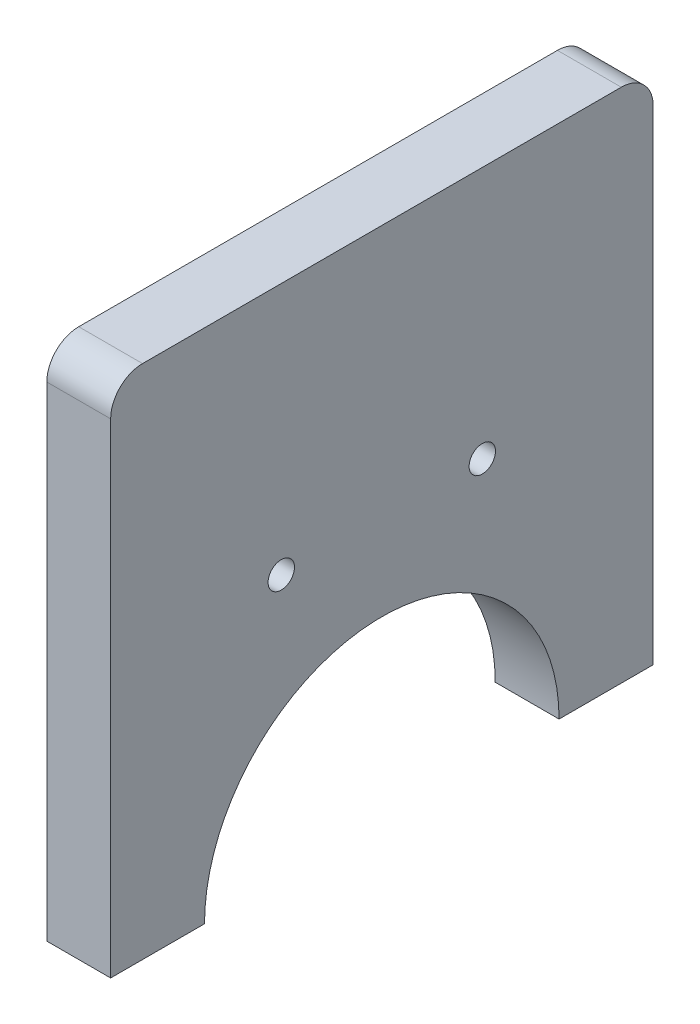
from build123d import *

# Parameters (mm, degrees)
BOSS_EXTRUDE1_START     = 5.08
BOSS_EXTRUDE1_DEPTH     = 43.18
SKETCH2_W               = 51
SKETCH2_H               = 8.231998532
BOSS_EXTRUDE2_DEPTH     = 5.08
CUT_EXTRUDE1_DEPTH      = 100.957396182
CUT_EXTRUDE1_DEPTH_BACK = 5.08
SKETCH3_R               = 1.05
SKETCH4_R               = 1.25
CUT_EXTRUDE2_DEPTH      = 5.08
SKETCH5_W               = 51
SKETCH5_H               = 8.231998532
BOSS_EXTRUDE3_DEPTH     = 5.08
BOSS_EXTRUDE4_DEPTH     = 5.08
FILLET1_R               = 2.54
SKETCH7_W               = 75.202673557
SKETCH7_H               = 41.660019182
CUT_EXTRUDE3_DEPTH      = 80.950255842


with BuildPart() as part:
    # Sketch1 → Boss-Extrude1 (new body)
    with BuildSketch(Plane.XY.offset(58.730428606).offset(BOSS_EXTRUDE1_START)):
        Polygon((-14.213699035, 28.595837466), (-14.213699035, 47.595837466), (36.786300965, 47.595837466), (36.786300965, 28.595837466), (41.866300965, 28.595837466), (41.866300965, 52.675837466), (-19.293699035, 52.675837466), (-19.293699035, 28.595837466), align=None)
    extrude(amount=-BOSS_EXTRUDE1_DEPTH)

    # Sketch2 → Boss-Extrude2 (add)
    with BuildSketch(Plane(origin=(0, 0, 20.630428606), x_dir=(-1, 0, 0), z_dir=(0, 0, -1))):
        with Locations((-11.286300965, 43.4798382)):
            Rectangle(SKETCH2_W, SKETCH2_H)
    extrude(amount=-BOSS_EXTRUDE2_DEPTH)

    # Sketch3 → Cut-Extrude1 (cut, two sides: drawn at the far end of the back side and taken through both)
    with BuildSketch(Plane.ZY.offset(-36.786300965).offset(-CUT_EXTRUDE1_DEPTH_BACK)):
        with Locations(Location((50.230428606, 32.595837466, 0), (0, 0, 180))):
            Circle(SKETCH3_R)
        with Locations(Location((34.230428606, 32.595837466, 0), (0, 0, 180))):
            Circle(SKETCH3_R)
    extrude(amount=CUT_EXTRUDE1_DEPTH + CUT_EXTRUDE1_DEPTH_BACK, mode=Mode.SUBTRACT)

    # Sketch4 → Cut-Extrude2 (cut)
    with BuildSketch(Plane(origin=(0, 47.595837466, 0), x_dir=(-1, 0, 0), z_dir=(0, -1, 0))):
        with Locations(Location((-22.286300965, -42.230428606, 0), (0, 0, 90))):
            Circle(SKETCH4_R)
        with Locations(Location((-11.286300965, -53.230428606, 0), (0, 0, 90))):
            Circle(SKETCH4_R)
        with Locations(Location((-11.286300965, -31.230428606, 0), (0, 0, 90))):
            Circle(SKETCH4_R)
        with Locations(Location((-0.286300965, -42.230428606, 0), (0, 0, 90))):
            Circle(SKETCH4_R)
    extrude(amount=-CUT_EXTRUDE2_DEPTH, mode=Mode.SUBTRACT)

    # Sketch5 → Boss-Extrude3 (add)
    with BuildSketch(Plane.XY.offset(63.810428606)):
        with Locations((11.286300965, 43.4798382)):
            Rectangle(SKETCH5_W, SKETCH5_H)
    extrude(amount=-BOSS_EXTRUDE3_DEPTH)

    # Sketch6 → Boss-Extrude4 (add)
    with BuildSketch(Plane.ZY.offset(19.293699035)):
        with BuildLine():
            Line((63.810428606, 28.595837466), (20.630428606, 28.595837466))
            Line((20.630428606, 28.595837466), (20.630428606, 11.595837466))
            Line((20.630428606, 11.595837466), (28.120807374, 11.595837466))
            ThreePointArc((28.120807374, 11.595837466), (42.230428606, 25.705458697), (56.340049838, 11.595837466))
            Line((56.340049838, 11.595837466), (63.810428606, 11.595837466))
            Line((63.810428606, 11.595837466), (63.810428606, 28.595837466))
        make_face()
    extrude(amount=-BOSS_EXTRUDE4_DEPTH)

    # Fillet1
    fillet1_edges = [part.edges().sort_by_distance(p)[0] for p in [
        (41.866300965, 52.675837466, 42.220428606),
        (39.326300965, 28.595837466, 20.630428606),
        (11.286300965, 52.675837466, 20.630428606),
        (-14.213699035, 39.363838934, 23.170428606),
        (-14.213699035, 39.363838934, 61.270428606),
        (11.286300965, 52.675837466, 63.810428606),
        (39.326300965, 28.595837466, 63.810428606),
    ]]
    fillet(fillet1_edges, radius=FILLET1_R)

    # Sketch7 → Cut-Extrude3 (cut, through all)
    with BuildSketch(Plane.XY.offset(63.810428606)):
        with Locations((23.387637744, 39.269623894)):
            Rectangle(SKETCH7_W, SKETCH7_H)
    extrude(amount=-CUT_EXTRUDE3_DEPTH, mode=Mode.SUBTRACT)


solid = part.part
